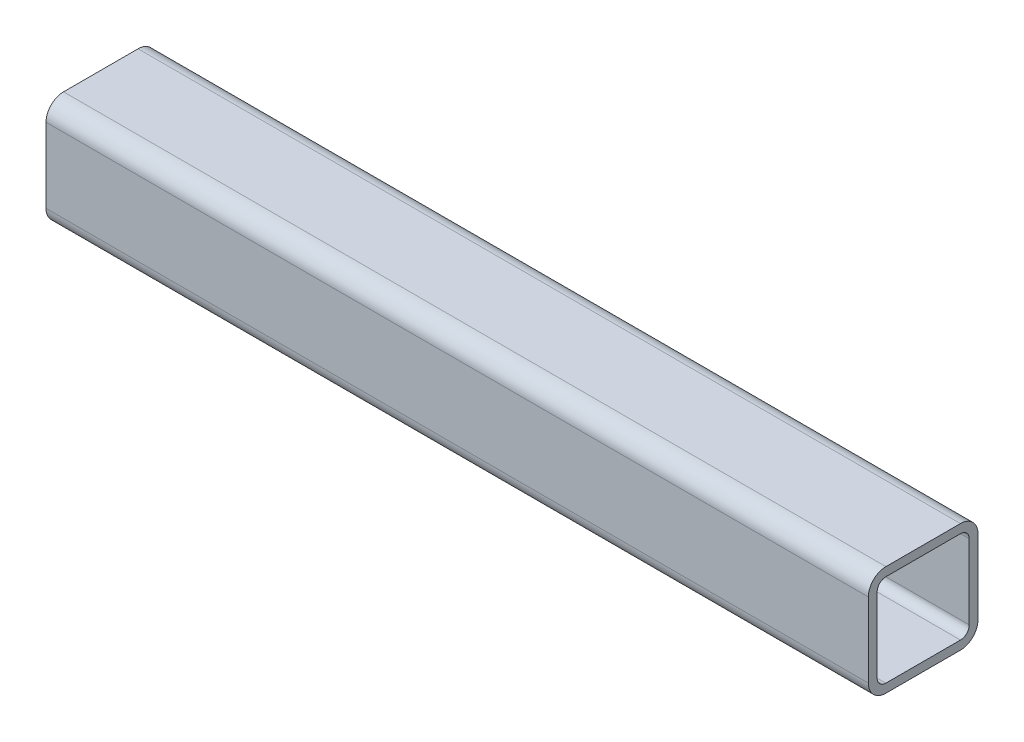
from build123d import *

# Parameters (mm, degrees)
TUBE_SQUARE_40_X_40_X_3_2_6_DEPTH = 300


with BuildPart() as part:
    # Sketch12 → Tube (square) 40 X 40 X 3.2(6) (new body)
    with BuildSketch(Plane(origin=(0, 0, 0), x_dir=(0, 0, -1), z_dir=(1, 0, 0))):
        with BuildLine():
            Line((-13.6, -20), (13.6, -20))
            ThreePointArc((13.6, -20), (18.1254834, -18.1254834), (20, -13.6))
            Line((20, -13.6), (20, 13.6))
            ThreePointArc((20, 13.6), (18.1254834, 18.1254834), (13.6, 20))
            Line((13.6, 20), (-13.6, 20))
            ThreePointArc((-13.6, 20), (-18.1254834, 18.1254834), (-20, 13.6))
            Line((-20, 13.6), (-20, -13.6))
            ThreePointArc((-20, -13.6), (-18.1254834, -18.1254834), (-13.6, -20))
        make_face()
        with BuildLine():
            Line((-13.6, -16.8), (13.6, -16.8))
            ThreePointArc((13.6, -16.8), (15.8627417, -15.8627417), (16.8, -13.6))
            Line((16.8, -13.6), (16.8, 13.6))
            ThreePointArc((16.8, 13.6), (15.8627417, 15.8627417), (13.6, 16.8))
            Line((13.6, 16.8), (-13.6, 16.8))
            ThreePointArc((-13.6, 16.8), (-15.8627417, 15.8627417), (-16.8, 13.6))
            Line((-16.8, 13.6), (-16.8, -13.6))
            ThreePointArc((-16.8, -13.6), (-15.8627417, -15.8627417), (-13.6, -16.8))
        make_face(mode=Mode.SUBTRACT)
    extrude(amount=TUBE_SQUARE_40_X_40_X_3_2_6_DEPTH)


solid = part.part
